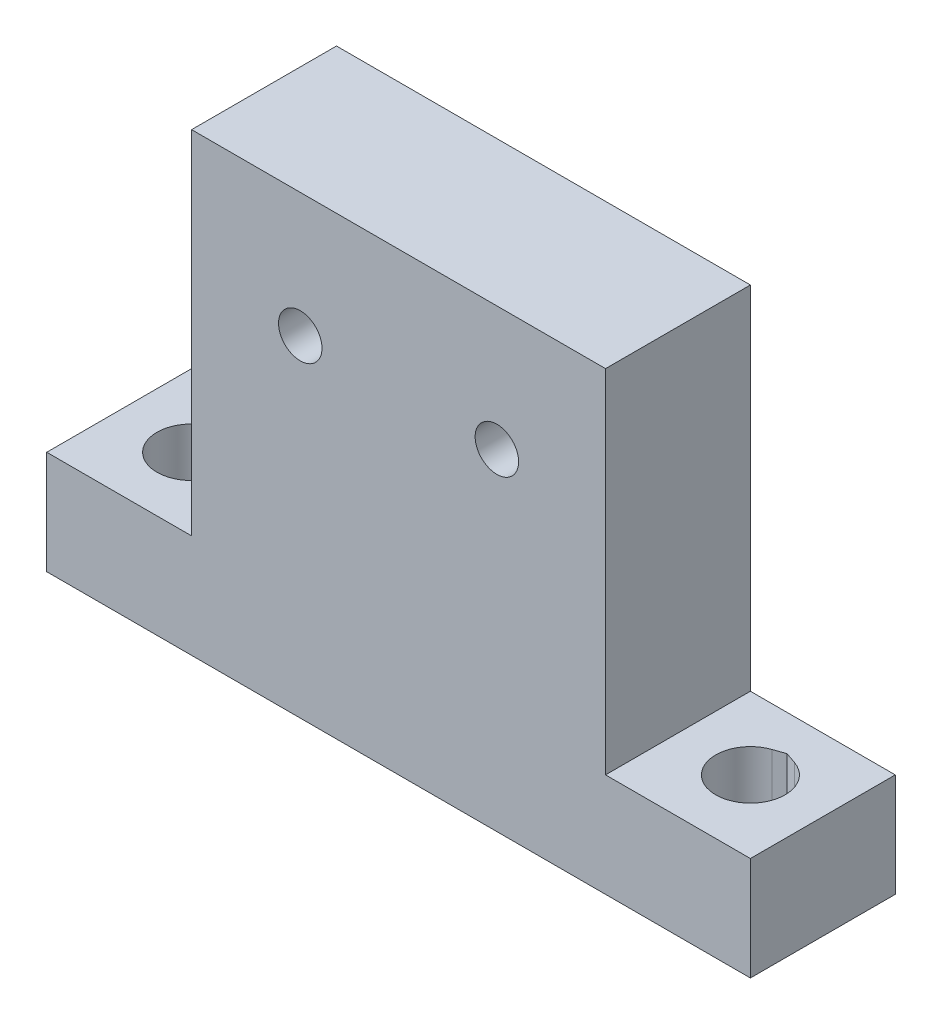
from build123d import *

# Parameters (mm, degrees)
SKETCH2_R           = 1.05
BOSS_EXTRUDE1_DEPTH = 7
CUT_EXTRUDE1_DEPTH  = 26.039968051


with BuildPart() as part:
    # Sketch2 → Boss-Extrude1 (new body)
    with BuildSketch(Plane.XY):
        Polygon((-10, 5), (-17, 5), (-17, 0), (17, 0), (17, 5), (10, 5), (10, 22), (-10, 22), align=None)
        with Locations((-4.75, 16)):
            Circle(SKETCH2_R, mode=Mode.SUBTRACT)
        with Locations(Location((4.75, 16, 0), (0, 0, 180))):
            Circle(SKETCH2_R, mode=Mode.SUBTRACT)
    extrude(amount=BOSS_EXTRUDE1_DEPTH)

    # Sketch3 → Cut-Extrude1 (cut, through all)
    with BuildSketch(Plane(origin=(0, 5, 0), x_dir=(1, 0, 0), z_dir=(0, 1, 0))):
        with BuildLine():
            Line((-13.5, -1.72667493), (-12.95, -1.917873267))
            ThreePointArc((-12.95, -1.917873267), (-13.5, -5.175), (-14.05, -1.917873267))
            Line((-14.05, -1.917873267), (-13.5, -1.72667493))
        make_face()
        with BuildLine():
            Line((13.5, -1.72667493), (14.05, -1.917873267))
            ThreePointArc((14.05, -1.917873267), (13.5, -5.175), (12.95, -1.917873267))
            Line((12.95, -1.917873267), (13.5, -1.72667493))
        make_face()
    extrude(amount=-CUT_EXTRUDE1_DEPTH, mode=Mode.SUBTRACT)


solid = part.part
